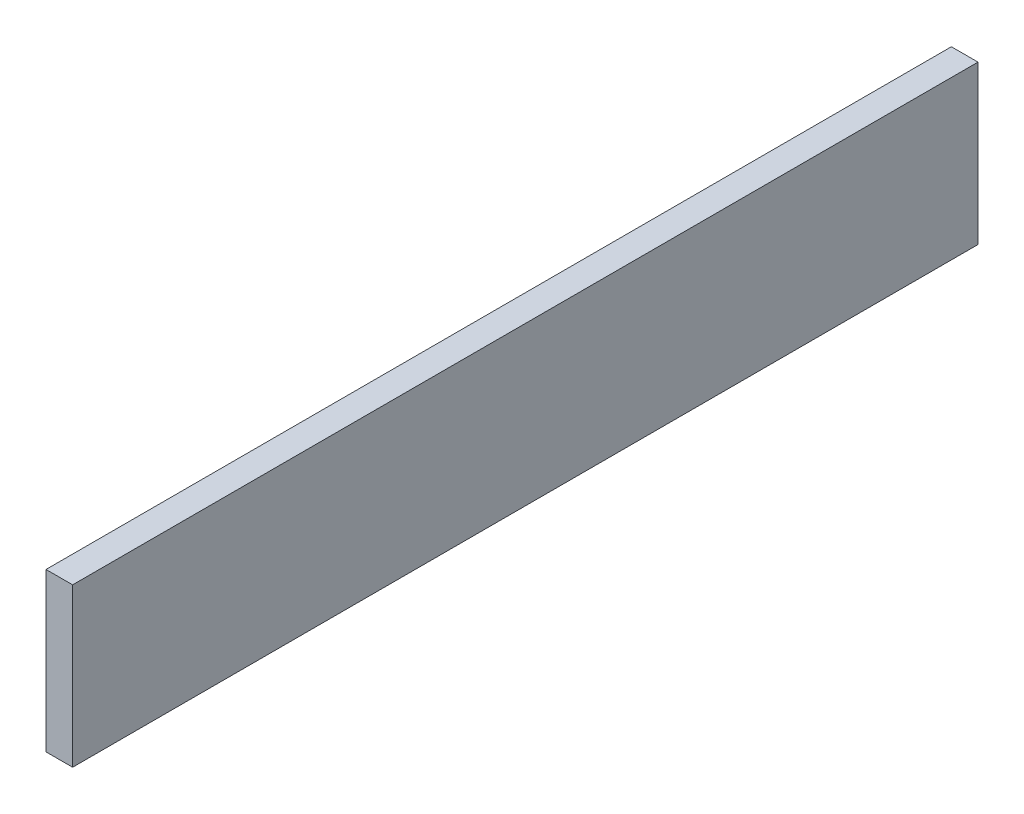
from build123d import *

# Parameters (mm, degrees)
CROQUIS1_W              = 510
CROQUIS1_H              = 89
SALIENTE_EXTRUIR1_DEPTH = 15


with BuildPart() as part:
    # Croquis1 → Saliente-Extruir1 (new body)
    with BuildSketch(Plane(origin=(0, 0, 0), x_dir=(0, 0, -1), z_dir=(1, 0, 0))):
        with Locations((255, 44.5)):
            Rectangle(CROQUIS1_W, CROQUIS1_H)
    extrude(amount=SALIENTE_EXTRUIR1_DEPTH)


solid = part.part
